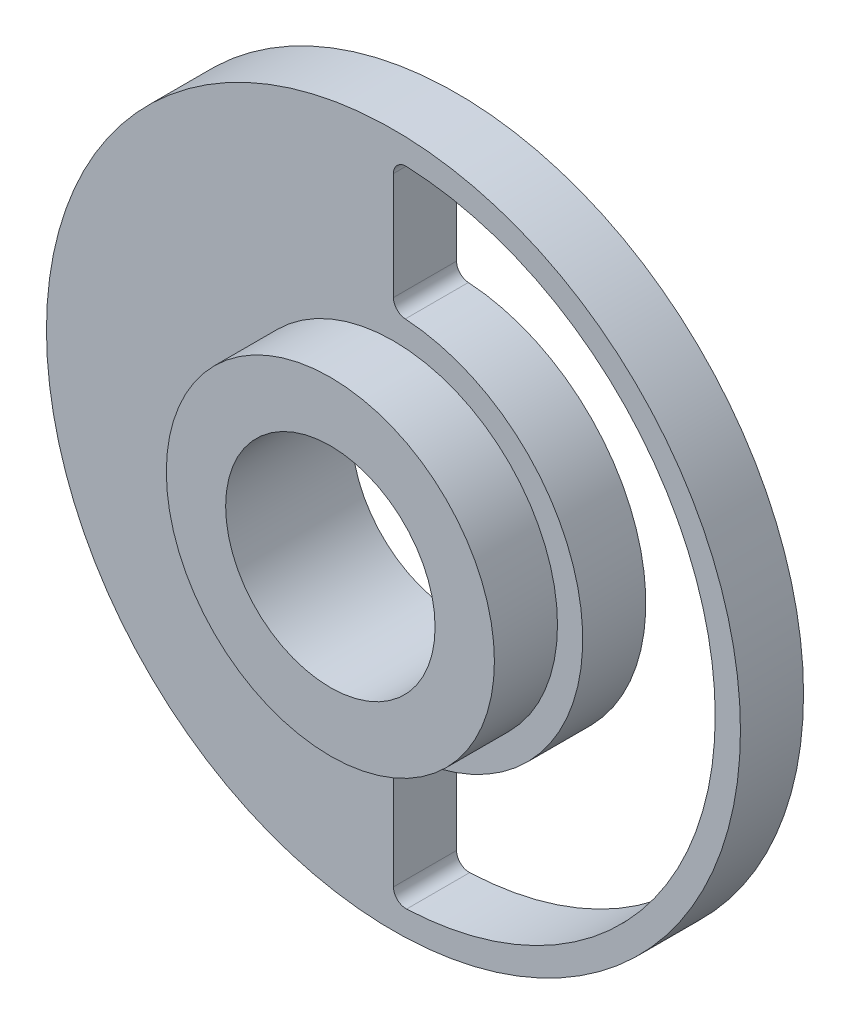
from build123d import *

# Parameters (mm, degrees)
SKETCH1_R           = 13.75
SKETCH1_R_2         = 4.15
BOSS_EXTRUDE1_DEPTH = 2.5
SKETCH2_R           = 6.5
SKETCH2_R_2         = 4.15
BOSS_EXTRUDE2_DEPTH = 2.5
CUT_EXTRUDE1_DEPTH  = 21.077973005
FILLET1_R           = 0.5


with BuildPart() as part:
    # Sketch1 → Boss-Extrude1 (new body)
    with BuildSketch(Plane.XY):
        Circle(SKETCH1_R)
        Circle(SKETCH1_R_2, mode=Mode.SUBTRACT)
    extrude(amount=BOSS_EXTRUDE1_DEPTH)

    # Sketch2 → Boss-Extrude2 (add)
    with BuildSketch(Plane.XY.offset(2.5)):
        Circle(SKETCH2_R)
        Circle(SKETCH2_R_2, mode=Mode.SUBTRACT)
    extrude(amount=BOSS_EXTRUDE2_DEPTH)

    # Sketch5 → Cut-Extrude1 (cut, through all)
    with BuildSketch(Plane.XY):
        with BuildLine():
            Line((0, 12.75), (0, 7.5))
            ThreePointArc((0, 7.5), (5.303300859, 5.303300859), (7.5, 0))
            ThreePointArc((7.5, 0), (5.303300859, -5.303300859), (0, -7.5))
            Line((0, -7.5), (0, -12.75))
            ThreePointArc((0, -12.75), (9.01561146, -9.01561146), (12.75, 0))
            ThreePointArc((12.75, 0), (9.01561146, 9.01561146), (0, 12.75))
        make_face()
    extrude(amount=CUT_EXTRUDE1_DEPTH, mode=Mode.SUBTRACT)

    # Fillet1
    fillet1_edges = [part.edges().sort_by_distance(p)[0] for p in [
        (0, 7.5, 1.25),
        (0, -7.5, 1.25),
        (0, -12.75, 1.25),
        (0, 12.75, 1.25),
    ]]
    fillet(fillet1_edges, radius=FILLET1_R)


solid = part.part
